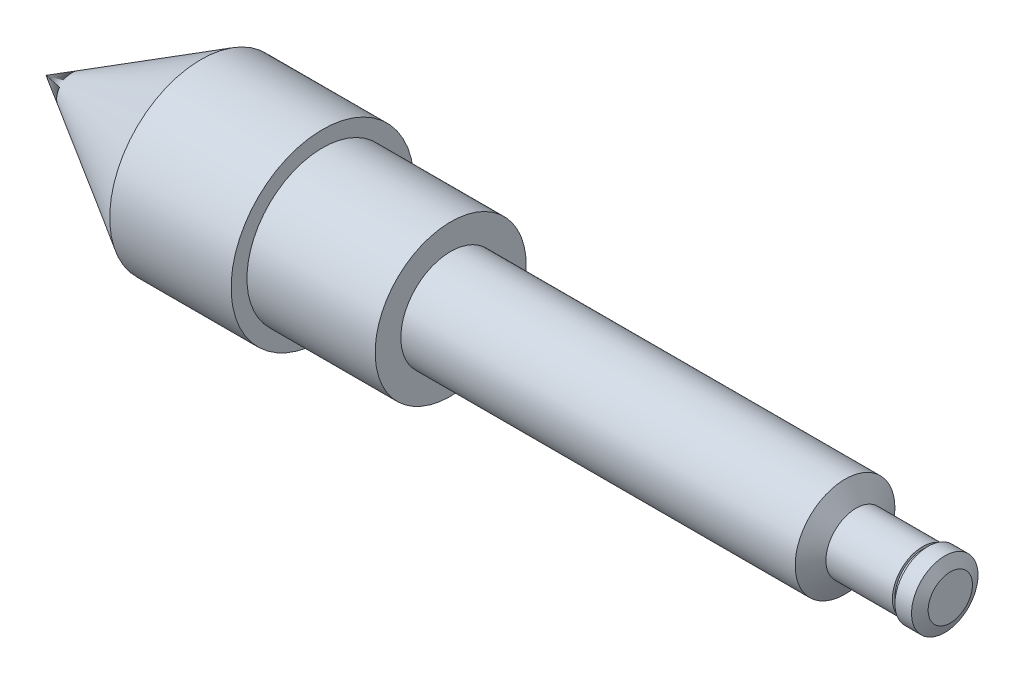
from build123d import *


with BuildPart() as part:
    # Sketch1 → Revolve1 (revolve)
    with BuildSketch(Plane(origin=(0, 0, 0), x_dir=(1, 0, 0), z_dir=(0, 1, 0)), mode=Mode.PRIVATE) as revolve1_sk:
        Polygon((0, -18.15), (-30.8, 0), (148.75, 0), (148.75, -4.4), (147.65, -6.6), (144.35, -6.6), (144.35, -5.5), (143.25, -5.5), (143.25, -6), (130.05, -6), (127.85, -9.9), (49.55, -9.9), (49.55, -15), (24.1, -15), (24.1, -18.15), align=None)
    revolve(revolve1_sk.sketch.rotate(Axis((148.75, 0, 0), (-1, 0, 0)), 180), axis=Axis((148.75, 0, 0), (-1, 0, 0)))


solid = part.part
